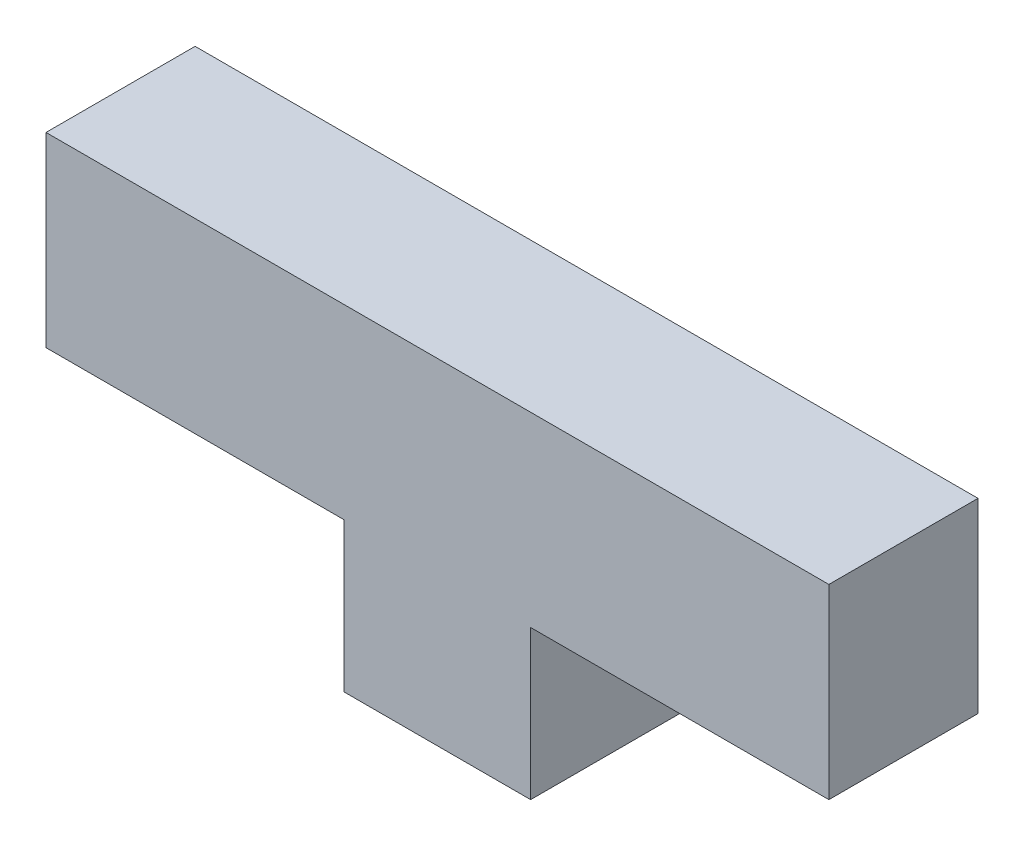
from build123d import *

# Parameters (mm, degrees)
BOSS_EXTRUDE1_DEPTH = 5.08


with BuildPart() as part:
    # Sketch1 → Boss-Extrude1 (new body)
    with BuildSketch(Plane.XY):
        Polygon((-3.175, -3.175), (-3.175, -8.255), (3.175, -8.255), (3.175, -3.175), (13.335, -3.175), (13.335, 3.175), (-13.335, 3.175), (-13.335, -3.175), align=None)
    extrude(amount=BOSS_EXTRUDE1_DEPTH)


solid = part.part
